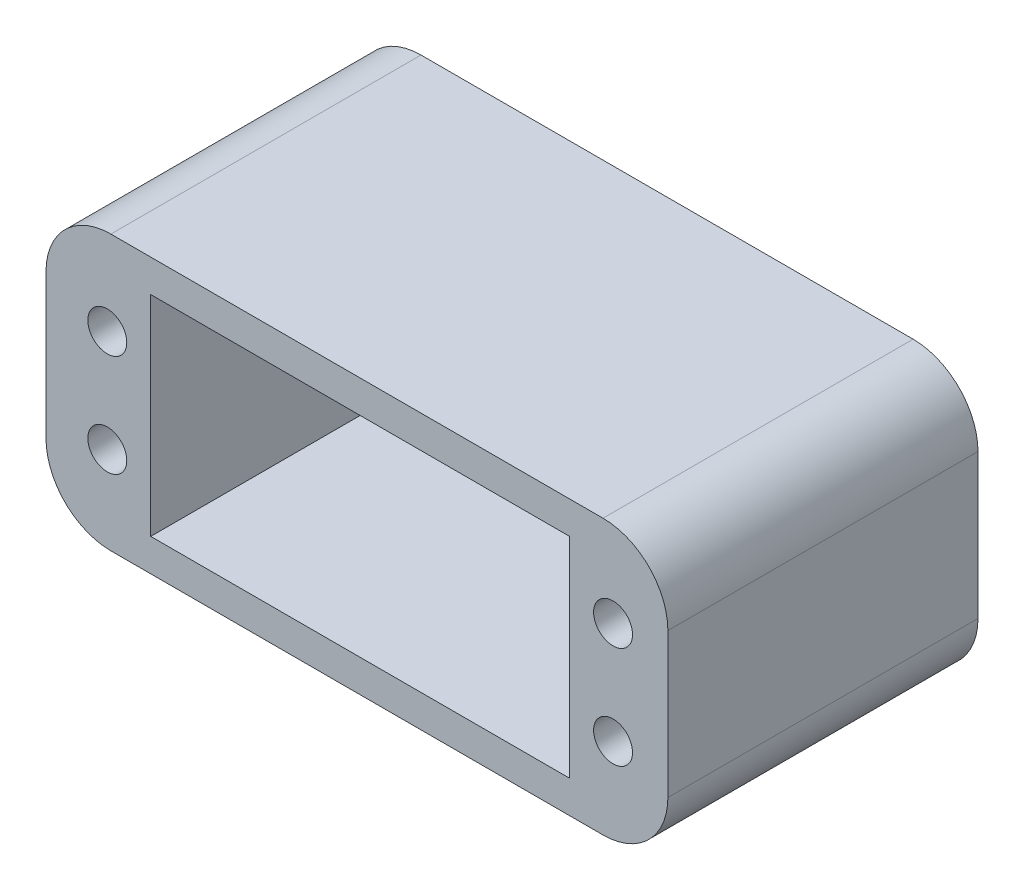
from build123d import *

# Parameters (mm, degrees)
BOSS_EXTRUDE1_DEPTH = 15.1765
SKETCH3_W           = 41
SKETCH3_H           = 20.5
CUT_EXTRUDE1_DEPTH  = 27.178
SKETCH4_R           = 1.905
CUT_EXTRUDE2_DEPTH  = 12.7
SKETCH5_W           = 6.35
SKETCH5_H           = 9.525
CUT_EXTRUDE3_DEPTH  = 10.25


with BuildPart() as part:
    # Sketch2 → Boss-Extrude1 (new, symmetric)
    with BuildSketch(Plane.XY):
        with BuildLine():
            Line((23.765883374, 13.425), (-24.4, 13.425))
            ThreePointArc((-24.4, 13.425), (-28.890128061, 11.565128061), (-30.75, 7.075))
            Line((-30.75, 7.075), (-30.75, -7.075))
            ThreePointArc((-30.75, -7.075), (-28.890128061, -11.565128061), (-24.4, -13.425))
            Line((-24.4, -13.425), (23.765883374, -13.425))
            ThreePointArc((23.765883374, -13.425), (28.256011435, -11.565128061), (30.115883374, -7.075))
            Line((30.115883374, -7.075), (30.115883374, 7.075))
            ThreePointArc((30.115883374, 7.075), (28.256011435, 11.565128061), (23.765883374, 13.425))
        make_face()
    extrude(amount=BOSS_EXTRUDE1_DEPTH, both=True)

    # Sketch3 → Cut-Extrude1 (cut)
    with BuildSketch(Plane.XY.offset(15.1765)):
        Rectangle(SKETCH3_W, SKETCH3_H)
    extrude(amount=-CUT_EXTRUDE1_DEPTH, mode=Mode.SUBTRACT)

    # Sketch4 → Cut-Extrude2 (cut)
    with BuildSketch(Plane.XY.offset(15.1765)):
        with Locations((-24.75, 5)):
            Circle(SKETCH4_R)
        with Locations((-24.75, -5)):
            Circle(SKETCH4_R)
        with Locations((24.75, -5)):
            Circle(SKETCH4_R)
        with Locations((24.75, 5)):
            Circle(SKETCH4_R)
    extrude(amount=-CUT_EXTRUDE2_DEPTH, mode=Mode.SUBTRACT)

    # Sketch5 → Cut-Extrude3 (cut)
    with BuildSketch(Plane.ZY.offset(30.75)):
        with Locations((-7.1755, 0)):
            Rectangle(SKETCH5_W, SKETCH5_H)
    extrude(amount=-CUT_EXTRUDE3_DEPTH, mode=Mode.SUBTRACT)


solid = part.part
